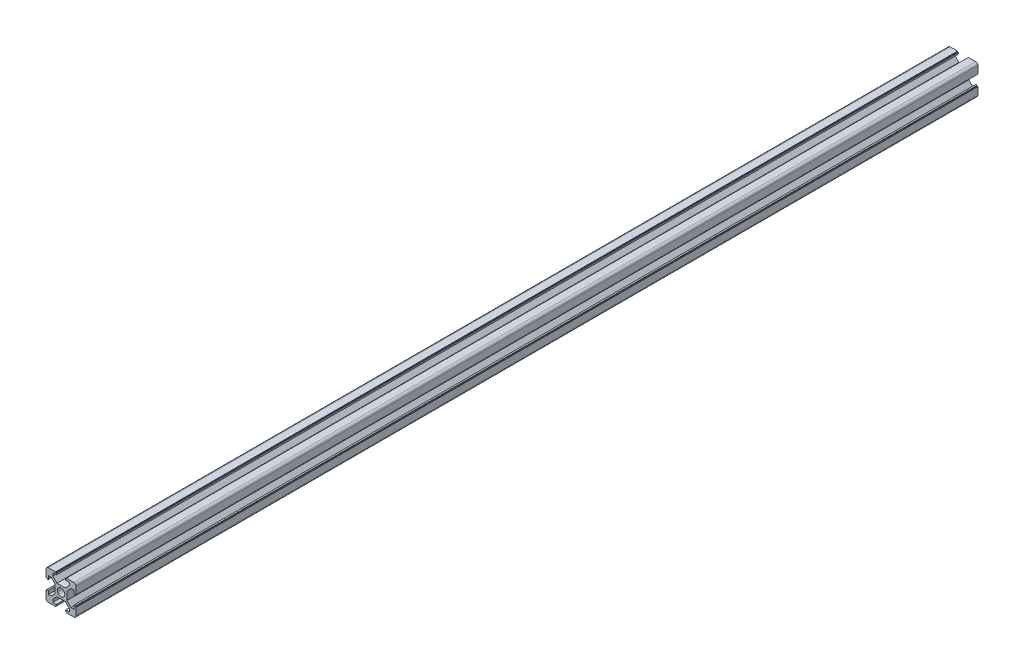
from build123d import *

# Parameters (mm, degrees)
SKETCH1_R                = 2.5
F_20_X_20_X_R1_5_1_DEPTH = 600


with BuildPart() as part:
    # Sketch1 → 铝型材 20 X 20 X R1.5(1) (new body)
    with BuildSketch(Plane.YX):
        with BuildLine():
            Line((-3.6, 10), (-3.6, 9.5))
            Line((-3.6, 9.5), (-3.1, 9.5))
            Line((-3.1, 9.5), (-3.1, 8.5))
            Line((-3.1, 8.5), (-5.5, 8.5))
            Line((-5.5, 8.5), (-5.5, 6.65))
            Line((-5.5, 6.65), (-2.75, 3.9))
            Line((-2.75, 3.9), (2.75, 3.9))
            Line((2.75, 3.9), (5.5, 6.65))
            Line((5.5, 6.65), (5.5, 8.5))
            Line((5.5, 8.5), (3.1, 8.5))
            Line((3.1, 8.5), (3.1, 9.5))
            Line((3.1, 9.5), (3.6, 9.5))
            Line((3.6, 9.5), (3.6, 10))
            Line((3.6, 10), (8.5, 10))
            ThreePointArc((8.5, 10), (9.560660172, 9.560660172), (10, 8.5))
            Line((10, 8.5), (10, 3.6))
            Line((10, 3.6), (9.5, 3.6))
            Line((9.5, 3.6), (9.5, 3.1))
            Line((9.5, 3.1), (8.5, 3.1))
            Line((8.5, 3.1), (8.5, 5.5))
            Line((8.5, 5.5), (6.65, 5.5))
            Line((6.65, 5.5), (3.9, 2.75))
            Line((3.9, 2.75), (3.9, -2.75))
            Line((3.9, -2.75), (6.65, -5.5))
            Line((6.65, -5.5), (8.5, -5.5))
            Line((8.5, -5.5), (8.5, -3.1))
            Line((8.5, -3.1), (9.5, -3.1))
            Line((9.5, -3.1), (9.5, -3.6))
            Line((9.5, -3.6), (10, -3.6))
            Line((10, -3.6), (10, -8.5))
            ThreePointArc((10, -8.5), (9.560660172, -9.560660172), (8.5, -10))
            Line((8.5, -10), (3.6, -10))
            Line((3.6, -10), (3.6, -9.5))
            Line((3.6, -9.5), (3.1, -9.5))
            Line((3.1, -9.5), (3.1, -8.5))
            Line((3.1, -8.5), (5.5, -8.5))
            Line((5.5, -8.5), (5.5, -6.65))
            Line((5.5, -6.65), (2.75, -3.9))
            Line((2.75, -3.9), (-2.75, -3.9))
            Line((-2.75, -3.9), (-5.5, -6.65))
            Line((-5.5, -6.65), (-5.5, -8.5))
            Line((-5.5, -8.5), (-3.1, -8.5))
            Line((-3.1, -8.5), (-3.1, -9.5))
            Line((-3.1, -9.5), (-3.6, -9.5))
            Line((-3.6, -9.5), (-3.6, -10))
            Line((-3.6, -10), (-8.5, -10))
            ThreePointArc((-8.5, -10), (-9.560660172, -9.560660172), (-10, -8.5))
            Line((-10, -8.5), (-10, -3.6))
            Line((-10, -3.6), (-9.5, -3.6))
            Line((-9.5, -3.6), (-9.5, -3.1))
            Line((-9.5, -3.1), (-8.5, -3.1))
            Line((-8.5, -3.1), (-8.5, -5.5))
            Line((-8.5, -5.5), (-6.65, -5.5))
            Line((-6.65, -5.5), (-3.9, -2.75))
            Line((-3.9, -2.75), (-3.9, 2.75))
            Line((-3.9, 2.75), (-6.65, 5.5))
            Line((-6.65, 5.5), (-8.5, 5.5))
            Line((-8.5, 5.5), (-8.5, 3.1))
            Line((-8.5, 3.1), (-9.5, 3.1))
            Line((-9.5, 3.1), (-9.5, 3.6))
            Line((-9.5, 3.6), (-10, 3.6))
            Line((-10, 3.6), (-10, 8.5))
            ThreePointArc((-10, 8.5), (-9.560660172, 9.560660172), (-8.5, 10))
            Line((-8.5, 10), (-3.6, 10))
        make_face()
        Circle(SKETCH1_R, mode=Mode.SUBTRACT)
    extrude(amount=F_20_X_20_X_R1_5_1_DEPTH)


solid = part.part
